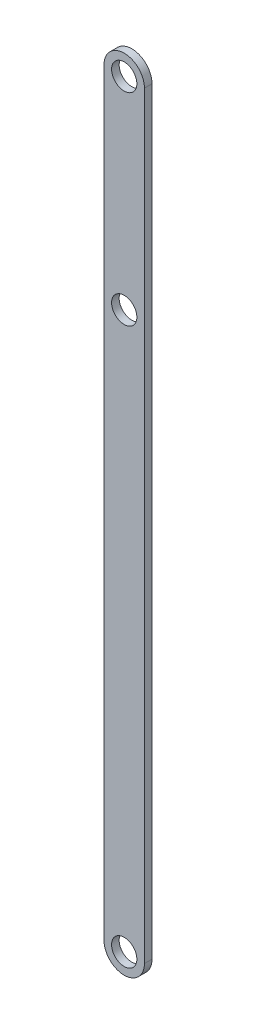
from build123d import *

# Parameters (mm, degrees)
SKETCH_1_R      = 0.5
EXTRUDE_1_DEPTH = 0.3


with BuildPart() as part:
    # 草圖1 → 填料-伸長1 (new body)
    with BuildSketch(Plane.XY):
        with BuildLine():
            Line((-0.8, -15), (-0.8, 15))
            ThreePointArc((-0.8, 15), (0, 15.8), (0.8, 15))
            Line((0.8, 15), (0.8, -15))
            ThreePointArc((0.8, -15), (0, -15.8), (-0.8, -15))
        make_face()
        with Locations((0, 15)):
            Circle(SKETCH_1_R, mode=Mode.SUBTRACT)
        with Locations((0, -15)):
            Circle(SKETCH_1_R, mode=Mode.SUBTRACT)
        with Locations((0, 7)):
            Circle(SKETCH_1_R, mode=Mode.SUBTRACT)
    extrude(amount=EXTRUDE_1_DEPTH)


solid = part.part
